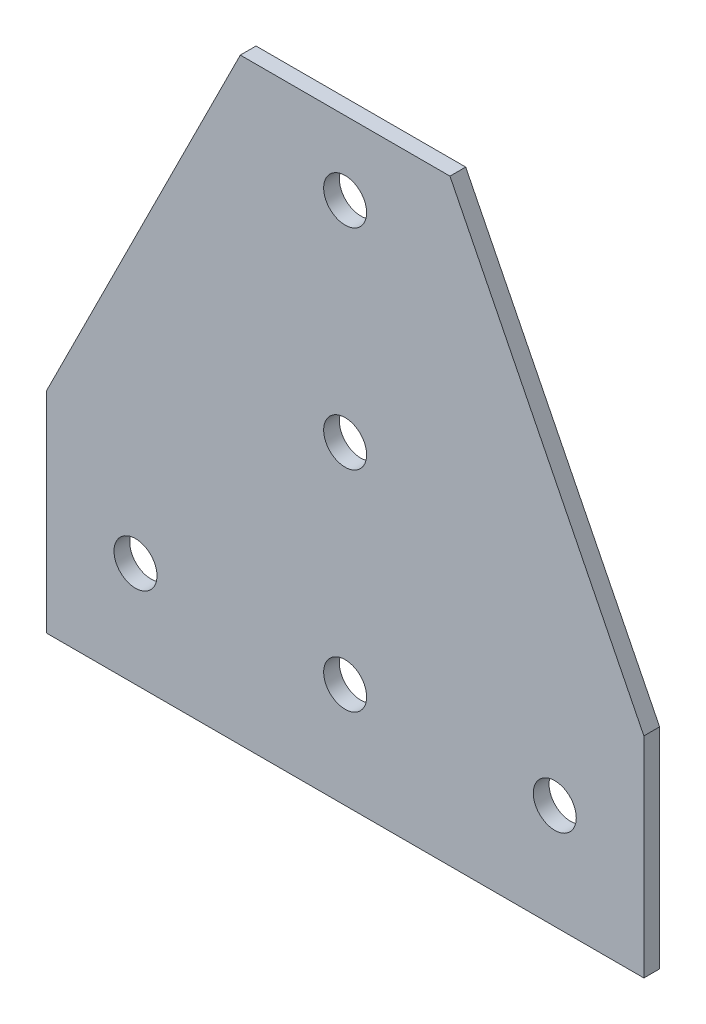
from build123d import *

# Parameters (mm, degrees)
SKETCH_1_R        = 4.1
EXTRUDE_405_DEPTH = 1.5


with BuildPart() as part:
    # Эскиз1 → Extrude 405 (new, symmetric)
    with BuildSketch(Plane.XY):
        Polygon((-57, -20), (57, -20), (57, 20), (20, 94), (-20, 94), (-57, 20), align=None)
        Circle(SKETCH_1_R, mode=Mode.SUBTRACT)
        with Locations((-40, 0)):
            Circle(SKETCH_1_R, mode=Mode.SUBTRACT)
        with Locations((40, 0)):
            Circle(SKETCH_1_R, mode=Mode.SUBTRACT)
        with Locations((0, 40)):
            Circle(SKETCH_1_R, mode=Mode.SUBTRACT)
        with Locations((0, 80)):
            Circle(SKETCH_1_R, mode=Mode.SUBTRACT)
    extrude(amount=EXTRUDE_405_DEPTH, both=True)


solid = part.part
